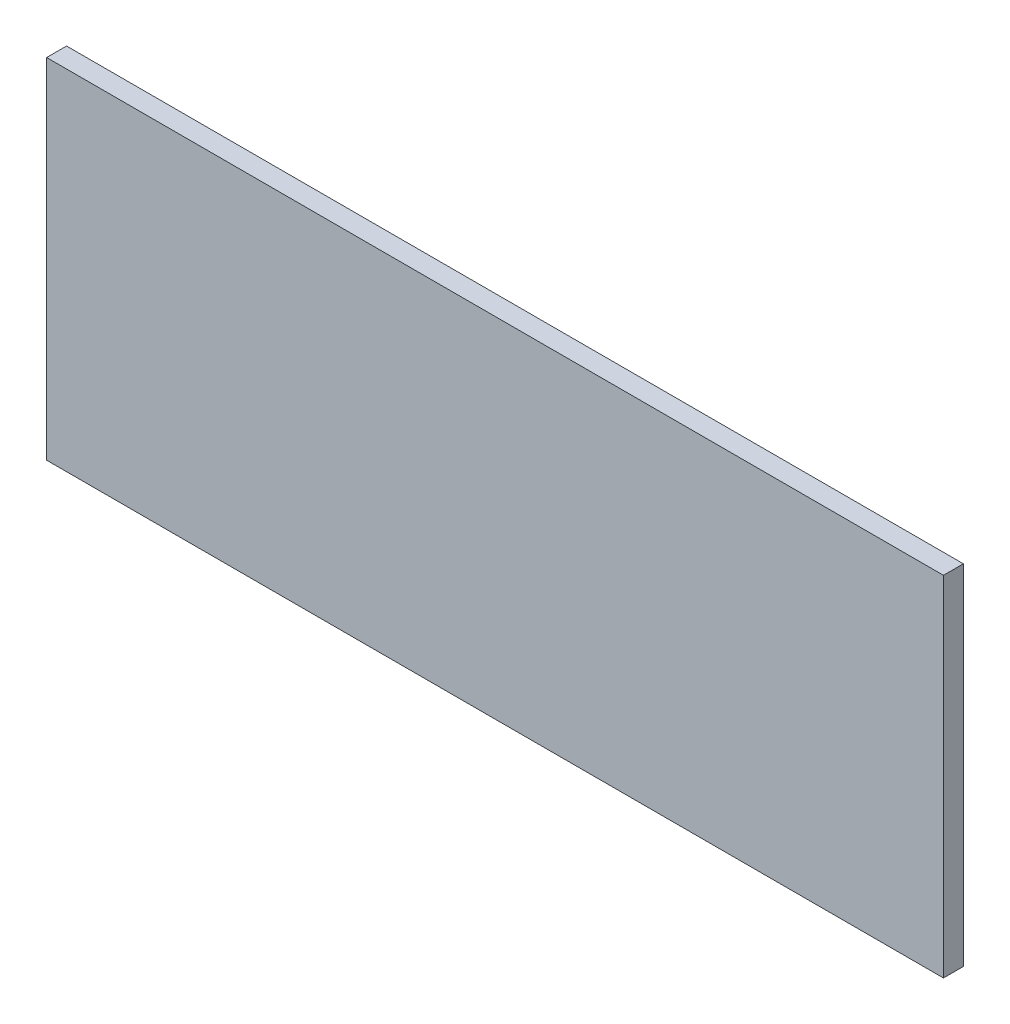
from build123d import *

# Parameters (mm, degrees)
SKETCH1_W           = 180
SKETCH1_H           = 70
BOSS_EXTRUDE1_DEPTH = 4


with BuildPart() as part:
    # Sketch1 → Boss-Extrude1 (new body)
    with BuildSketch(Plane.XY):
        Rectangle(SKETCH1_W, SKETCH1_H)
    extrude(amount=BOSS_EXTRUDE1_DEPTH)


solid = part.part
